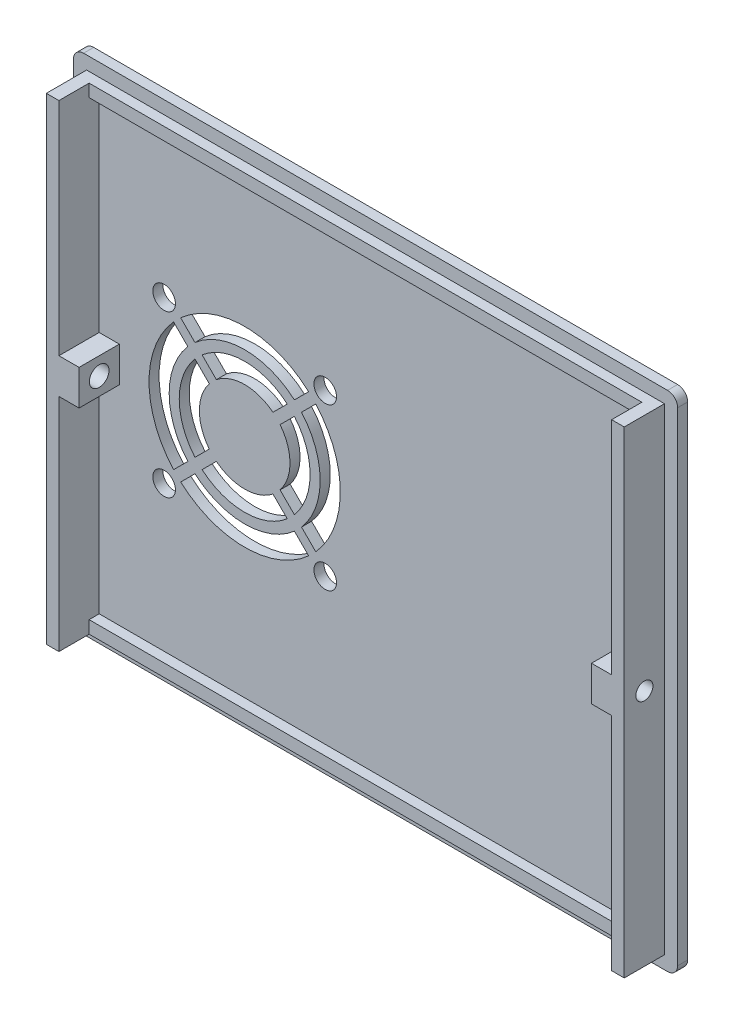
from build123d import *

# Parameters (mm, degrees)
P_DORYS_W                                         = 120
P_DORYS_H                                         = 100
P_IDAT_VYSUNUT_M1_DEPTH                           = 2
ZAOBLIT1_R                                        = 2
SKICA2_W                                          = 114.8
SKICA2_H                                          = 94.8
SKICA2_W_2                                        = 109.8
SKICA2_H_2                                        = 89.8
SKICA2_W_3                                        = 4
SKICA2_H_3                                        = 7
SKICA2_H_4                                        = 3.5
P_IDAT_VYSUNUT_M2_DEPTH                           = 2
P_IDAT_VYSUNUT_M3_DEPTH                           = 6
V_LCOV_ZAHLOUBEN_PRO_M6_ROUBY_S_V_LCO_D           = 3.4
V_LCOV_ZAHLOUBEN_PRO_M6_ROUBY_S_V_LCO_DEPTH       = 9.1
V_LCOV_ZAHLOUBEN_PRO_M6_ROUBY_S_V_LCO_CBORE_D     = 3.9
V_LCOV_ZAHLOUBEN_PRO_M6_ROUBY_S_V_LCO_CBORE_DEPTH = 4
SKICA7_R                                          = 2.25
ODEBRAT_VYSUNUT_M1_DEPTH                          = 6


with BuildPart() as part:
    # půdorys → Přidat vysunutím1 (new body)
    with BuildSketch(Plane.XY):
        Rectangle(P_DORYS_W, P_DORYS_H)
    extrude(amount=P_IDAT_VYSUNUT_M1_DEPTH)

    # Zaoblit1
    zaoblit1_edges = [part.edges().sort_by_distance(p)[0] for p in [
        (60, -50, 1),
        (-60, -50, 1),
        (-60, 50, 1),
        (60, 50, 1),
    ]]
    fillet(zaoblit1_edges, radius=ZAOBLIT1_R)

    # Skica2 → Přidat vysunutím2 (add)
    # profile 1 of 4: a face of its own
    with BuildSketch(Plane.XY.offset(2)):
        Rectangle(SKICA2_W, SKICA2_H)
        Rectangle(SKICA2_W_2, SKICA2_H_2, mode=Mode.SUBTRACT)
    # profile 2 of 4: a face of its own
    with BuildSketch(Plane.XY.offset(2)):
        with Locations((52.9, 0)):
            Rectangle(SKICA2_W_3, SKICA2_H_3)
    # profile 3 of 4: a face of its own
    with BuildSketch(Plane.XY.offset(2)):
        with Locations((-52.9, -1.75)):
            Rectangle(SKICA2_W_3, SKICA2_H_4)
    # profile 4 of 4: a face of its own
    with BuildSketch(Plane.XY.offset(2)):
        with Locations((-52.9, 1.75)):
            Rectangle(SKICA2_W_3, SKICA2_H_4)
    extrude(amount=P_IDAT_VYSUNUT_M2_DEPTH)

    # Skica3 → Přidat vysunutím3 (add)
    with BuildSketch(Plane.XY.offset(4)):
        Polygon((54.9, -47.4), (57.4, -47.4), (57.4, 47.4), (54.9, 47.4), (54.9, 44.9), (54.9, 3.5), (50.9, 3.5), (50.9, -3.5), (54.9, -3.5), (54.9, -44.9), align=None)
        Polygon((-57.4, -47.4), (-54.9, -47.4), (-54.9, -44.9), (-54.9, -3.5), (-50.9, -3.5), (-50.9, 3.5), (-54.9, 3.5), (-54.9, 44.9), (-54.9, 47.4), (-57.4, 47.4), align=None)
    extrude(amount=P_IDAT_VYSUNUT_M3_DEPTH)

    # Válcové zahloubení pro M6 šrouby s válcovou hlavou zaoblenou1
    with Locations(Plane(origin=(-50.9, 0, 6), x_dir=(0, 0, 1), z_dir=(1, 0, 0))):
        with Locations((0, 0)):
            v_lcov_zahlouben_pro_m6_rouby_s_v_lco = CounterBoreHole(V_LCOV_ZAHLOUBEN_PRO_M6_ROUBY_S_V_LCO_D / 2, V_LCOV_ZAHLOUBEN_PRO_M6_ROUBY_S_V_LCO_CBORE_D / 2, V_LCOV_ZAHLOUBEN_PRO_M6_ROUBY_S_V_LCO_CBORE_DEPTH, depth=V_LCOV_ZAHLOUBEN_PRO_M6_ROUBY_S_V_LCO_DEPTH)

    # Zrcadlit1: Válcové zahloubení pro M6 šrouby s válcovou hlavou zaoblenou1 across plane
    add(v_lcov_zahlouben_pro_m6_rouby_s_v_lco.mirror(Plane(origin=(0, 0, 0), x_dir=(0, 0, 1), z_dir=(1, 0, 0))), mode=Mode.SUBTRACT)

    # Skica7 → Odebrat vysunutím1 (cut)
    with BuildSketch(Plane(origin=(0, 0, 0), x_dir=(-1, 0, 0), z_dir=(0, 0, -1))):
        with BuildLine():
            ThreePointArc((37.290080195, 9.875934852), (41, 2.4173e-05), (37.290112025, -9.875898463))
            Line((37.290112025, -9.875898463), (40.123514646, -12.709301084))
            ThreePointArc((40.123514646, -12.709301084), (45, 2.4153e-05), (40.123482334, 12.709336991))
            Line((40.123482334, 12.709336991), (37.290080195, 9.875934852))
        make_face()
        with BuildLine():
            ThreePointArc((35.872258171, -8.458044609), (39, 2.4191e-05), (35.872226693, 8.45808135))
            Line((35.872226693, 8.45808135), (33.031631805, 5.617486462))
            ThreePointArc((33.031631805, 5.617486462), (35, 2.427e-05), (33.031662102, -5.617448539))
            Line((33.031662102, -5.617448539), (35.872258171, -8.458044609))
        make_face()
        with Locations((42, -16)):
            Circle(SKICA7_R)
        with Locations((42, 16)):
            Circle(SKICA7_R)
        with BuildLine():
            ThreePointArc((16.124101537, 11.290112025), (26, 15), (35.875898463, 11.290112025))
            Line((35.875898463, 11.290112025), (38.709301084, 14.123514646))
            ThreePointArc((38.709301084, 14.123514646), (26, 19), (13.290698916, 14.123514646))
            Line((13.290698916, 14.123514646), (16.124101537, 11.290112025))
        make_face()
        with BuildLine():
            Line((38.709301084, -14.123514646), (35.875898463, -11.290112025))
            ThreePointArc((35.875898463, -11.290112025), (25.999975827, -15), (16.124065148, -11.290080195))
            Line((16.124065148, -11.290080195), (13.290663009, -14.123482334))
            ThreePointArc((13.290663009, -14.123482334), (25.999975847, -19), (38.709301084, -14.123514646))
        make_face()
        with BuildLine():
            Line((31.617448539, 7.031662102), (34.458044609, 9.872258171))
            ThreePointArc((34.458044609, 9.872258171), (26, 13), (17.541955391, 9.872258171))
            Line((17.541955391, 9.872258171), (20.382551461, 7.031662102))
            ThreePointArc((20.382551461, 7.031662102), (26, 9), (31.617448539, 7.031662102))
        make_face()
        with BuildLine():
            ThreePointArc((17.54191865, -9.872226693), (25.999975809, -13), (34.458044609, -9.872258171))
            Line((34.458044609, -9.872258171), (31.617448539, -7.031662102))
            ThreePointArc((31.617448539, -7.031662102), (25.99997573, -9), (20.382513538, -7.031631805))
            Line((20.382513538, -7.031631805), (17.54191865, -9.872226693))
        make_face()
        with BuildLine():
            ThreePointArc((18.968337898, -5.617448539), (17, 0), (18.968337898, 5.617448539))
            Line((18.968337898, 5.617448539), (16.127741829, 8.458044609))
            ThreePointArc((16.127741829, 8.458044609), (13, 0), (16.127741829, -8.458044609))
            Line((16.127741829, -8.458044609), (18.968337898, -5.617448539))
        make_face()
        with Locations((10, 16)):
            Circle(SKICA7_R)
        with BuildLine():
            Line((14.709887975, 9.875898463), (11.876485354, 12.709301084))
            ThreePointArc((11.876485354, 12.709301084), (7, 0), (11.876485354, -12.709301084))
            Line((11.876485354, -12.709301084), (14.709887975, -9.875898463))
            ThreePointArc((14.709887975, -9.875898463), (11, 0), (14.709887975, 9.875898463))
        make_face()
        with Locations((10, -16)):
            Circle(SKICA7_R)
    extrude(amount=-ODEBRAT_VYSUNUT_M1_DEPTH, mode=Mode.SUBTRACT)


solid = part.part
